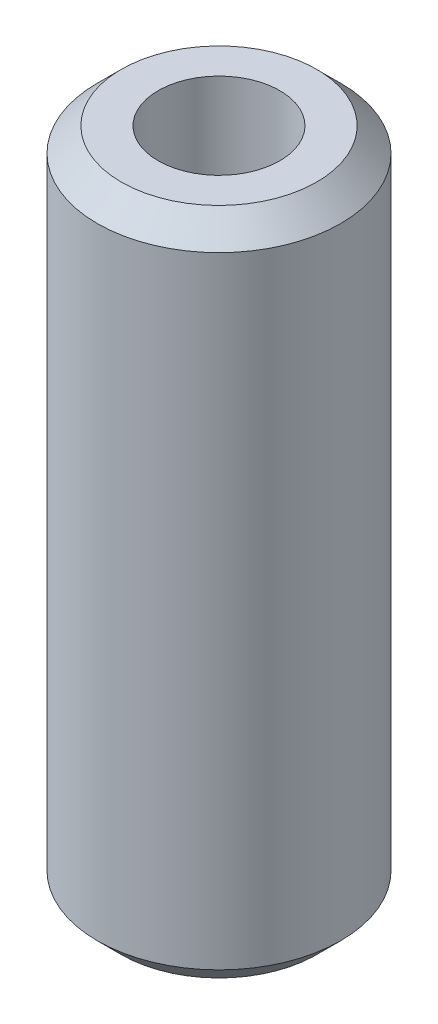
from build123d import *

# Parameters (mm, degrees)
SKETCH2_R           = 12.7
SKETCH2_R_2         = 6.35
BOSS_EXTRUDE1_DEPTH = 34.925
CHAMFER1_SIZE       = 2.5


with BuildPart() as part:
    # Sketch2 → Boss-Extrude1 (new, symmetric)
    with BuildSketch(Plane(origin=(0, 0, 0), x_dir=(1, 0, 0), z_dir=(0, 1, 0))):
        with Locations(Location((0, 0, 0), (0, 0, 270))):
            Circle(SKETCH2_R)
        with Locations(Location((0, 0, 0), (0, 0, 270))):
            Circle(SKETCH2_R_2, mode=Mode.SUBTRACT)
    extrude(amount=BOSS_EXTRUDE1_DEPTH, both=True)

    # Chamfer1
    chamfer1_edges = [part.edges().sort_by_distance(p)[0] for p in [
        (0, -34.925, -12.7),
        (0, 34.925, -12.7),
    ]]
    chamfer(chamfer1_edges, length=CHAMFER1_SIZE)


solid = part.part
